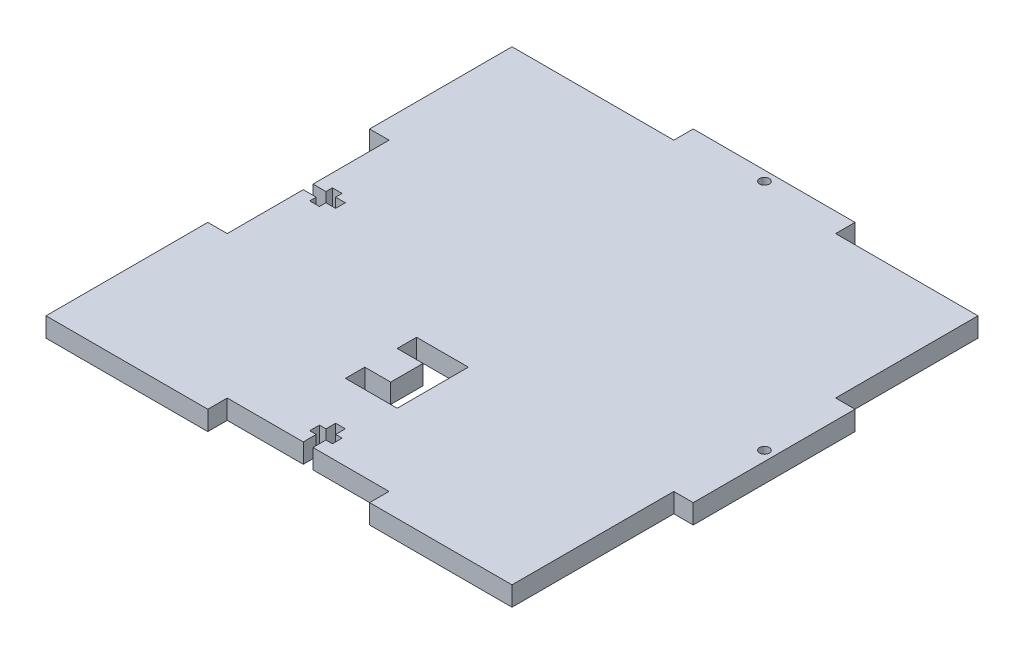
from build123d import *

# Parameters (mm, degrees)
SKETCH1_R           = 1.5
BOSS_EXTRUDE1_DEPTH = 6


with BuildPart() as part:
    # Sketch1 → Boss-Extrude1 (new body)
    with BuildSketch(Plane(origin=(0, 0, 0), x_dir=(1, 0, 0), z_dir=(0, 1, 0))):
        Polygon((-72, 72), (-72, 28), (-66, 28), (-66, 4.5), (-62, 4.5), (-62, 6.5), (-59, 6.5), (-59, 4.5), (-56, 4.5), (-56, 1.5), (-59, 1.5), (-59, -0.5), (-62, -0.5), (-62, 1.5), (-66, 1.5), (-66, -22), (-72, -22), (-72, -72), (-22, -72), (-22, -66), (1.5, -66), (1.5, -62), (-0.5, -62), (-0.5, -59), (1.5, -59), (1.5, -56), (4.5, -56), (4.5, -59), (6.5, -59), (6.5, -62), (4.5, -62), (4.5, -66), (28, -66), (28, -72), (72, -72), (72, -22), (78, -22), (78, 28), (72, 28), (72, 72), (28, 72), (28, 78), (-22, 78), (-22, 72), align=None)
        Polygon((-9, -20.484869039), (7, -20.484869039), (7, -42.484869039), (-9, -42.484869039), (-9, -36.484869039), (-1, -36.484869039), (-1, -26.484869039), (-9, -26.484869039), align=None, mode=Mode.SUBTRACT)
        with Locations(Location((3, 75, 0), (0, 0, 270))):
            Circle(SKETCH1_R, mode=Mode.SUBTRACT)
        with Locations(Location((75, 3, 0), (0, 0, 270))):
            Circle(SKETCH1_R, mode=Mode.SUBTRACT)
    extrude(amount=BOSS_EXTRUDE1_DEPTH)


solid = part.part
